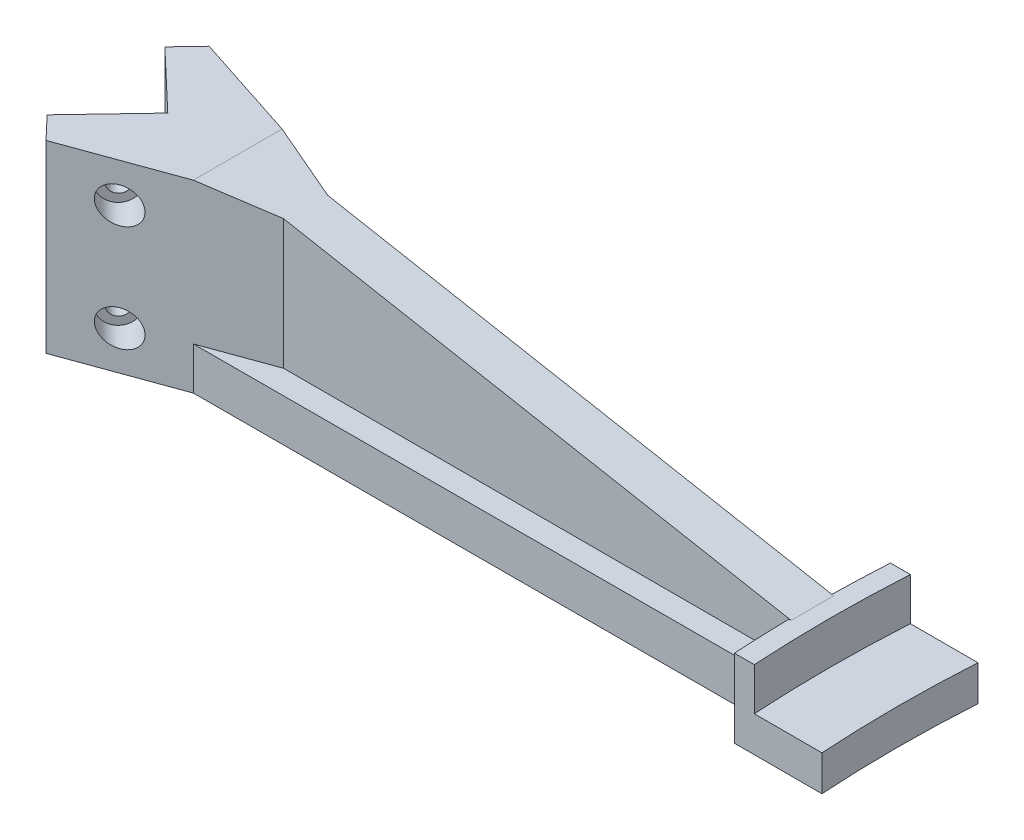
from build123d import *

# Parameters (mm, degrees)
BOSS_EXTRUDE2_DEPTH          = 12
BOSS_EXTRUDE3_START          = -2
BOSS_EXTRUDE3_DEPTH          = 10
BOSS_EXTRUDE4_START          = 10
BOSS_EXTRUDE4_DEPTH          = 22
BOSS_EXTRUDE7_DEPTH          = 40
BOSS_EXTRUDE17_DEPTH         = 6
BOSS_EXTRUDE17_DEPTH_BACK    = 6
CUT_EXTRUDE_THIN1_DEPTH      = 204.107832617
CUT_EXTRUDE_THIN1_DEPTH_BACK = 204.107832617
CUT_EXTRUDE1_START           = -8
SKETCH6_R                    = 5
CUT_EXTRUDE1_DEPTH           = 163.861994657
SKETCH6_4_R                  = 2.75
CUT_EXTRUDE2_DEPTH           = 171.861994657


with BuildPart() as part:
    # Sketch2 → Boss-Extrude2 (new body)
    with BuildSketch(Plane(origin=(0, 0, 0), x_dir=(1, 0, 0), z_dir=(0, 1, 0))):
        with BuildLine():
            Line((-197.696610314, 15.743442535), (-181.12456554, 0))
            Line((-181.12456554, 0), (-197.696610314, -17.444257657))
            Line((-197.696610314, -17.444257657), (-191.610767905, -23.850407561))
            Line((-191.610767905, -23.850407561), (-161.12456554, -12.777855375))
            Line((-161.12456554, -12.777855375), (0.21086679, -12.5))
            ThreePointArc((0.21086679, -12.5), (0.401744327, -17.25142014), (0.653571446, -22))
            Line((0.653571446, -22), (6.263616969, -22))
            ThreePointArc((6.263616969, -22), (5.6, 0), (6.263616969, 22))
            Line((6.263616969, 22), (0.653571446, 22))
            ThreePointArc((0.653571446, 22), (0.401744327, 17.25142014), (0.21086679, 12.5))
            Line((0.21086679, 12.5), (-161.12456554, 12.222144625))
            Line((-161.12456554, 12.222144625), (-191.610767905, 22.149592439))
            Line((-191.610767905, 22.149592439), (-197.696610314, 15.743442535))
        make_face()
    extrude(amount=-BOSS_EXTRUDE2_DEPTH)

    # Sketch2<5> → Boss-Extrude3 (add)
    with BuildSketch(Plane(origin=(0, 0, 0), x_dir=(1, 0, 0), z_dir=(0, 1, 0)).offset(BOSS_EXTRUDE3_START)):
        with BuildLine():
            Line((25.340211435, 22), (6.263616969, 22))
            ThreePointArc((6.263616969, 22), (5.6, 0), (6.263616969, -22))
            Line((6.263616969, -22), (25.340211435, -22))
            ThreePointArc((25.340211435, -22), (24.64, 0), (25.340211435, 22))
        make_face()
    extrude(amount=-BOSS_EXTRUDE3_DEPTH)

    # Sketch2<6> → Boss-Extrude4 (add)
    with BuildSketch(Plane(origin=(0, 0, 0), x_dir=(1, 0, 0), z_dir=(0, 1, 0)).offset(BOSS_EXTRUDE4_START)):
        with BuildLine():
            ThreePointArc((0.653571446, 22), (0.401744327, 17.25142014), (0.21086679, 12.5))
            ThreePointArc((0.21086679, 12.5), (0, 0), (0.21086679, -12.5))
            ThreePointArc((0.21086679, -12.5), (0.401744327, -17.25142014), (0.653571446, -22))
            Line((0.653571446, -22), (6.263616969, -22))
            ThreePointArc((6.263616969, -22), (5.6, 0), (6.263616969, 22))
            Line((6.263616969, 22), (0.653571446, 22))
        make_face()
    extrude(amount=-BOSS_EXTRUDE4_DEPTH)

    # Sketch2<9> → Boss-Extrude7 (add)
    with BuildSketch(Plane(origin=(0, 0, 0), x_dir=(1, 0, 0), z_dir=(0, 1, 0))):
        Polygon((-197.696610314, 15.743442535), (-181.12456554, 0), (-197.696610314, -17.444257657), (-191.610767905, -23.850407561), (-124.831467486, 0.40375437), (-191.610767905, 22.149592439), align=None)
    extrude(amount=BOSS_EXTRUDE7_DEPTH)

    # Sketch4 → Boss-Extrude17 (add, two sides: drawn at the far end of the back side and taken through both)
    with BuildSketch(Plane.XY.offset(-BOSS_EXTRUDE17_DEPTH_BACK)):
        Polygon((0.653571446, 10), (-161.12456554, 40), (-161.12456554, 0), (0.653571446, 0), align=None)
    extrude(amount=BOSS_EXTRUDE17_DEPTH + BOSS_EXTRUDE17_DEPTH_BACK)

    # Sketch5 → Cut-Extrude-Thin1 (cut, two sides: drawn at the far end of the back side and taken through both)
    with BuildSketch(Plane.XY.offset(-CUT_EXTRUDE_THIN1_DEPTH_BACK)):
        Polygon((0.653571446, 10), (-161.12456554, 40), (-159.301258723, 49.832372666), (2.476878263, 19.832372666), align=None)
    extrude(amount=CUT_EXTRUDE_THIN1_DEPTH + CUT_EXTRUDE_THIN1_DEPTH_BACK, mode=Mode.SUBTRACT)

    # Sketch6 → Cut-Extrude1 (cut, through all)
    with BuildSketch(Plane(origin=(-95.203451007, 0, -90.443278456), x_dir=(-0.6887494619146907, 0, 0.724999433594416), z_dir=(-0.724999433594416, 0, -0.6887494619146907)).offset(CUT_EXTRUDE1_START)):
        with Locations((134.749447055, 29)):
            Circle(SKETCH6_R)
        with Locations((134.749447055, -1)):
            Circle(SKETCH6_R)
    cut_extrude1 = extrude(amount=-CUT_EXTRUDE1_DEPTH, mode=Mode.SUBTRACT)

    # Sketch6<4> → Cut-Extrude2 (cut, symmetric)
    with BuildSketch(Plane(origin=(-95.203451007, 0, -90.443278456), x_dir=(-0.6887494619146907, 0, 0.724999433594416), z_dir=(-0.724999433594416, 0, -0.6887494619146907))):
        with Locations((134.749447055, 29)):
            Circle(SKETCH6_4_R)
        with Locations((134.749447055, -1)):
            Circle(SKETCH6_4_R)
    cut_extrude2 = extrude(amount=CUT_EXTRUDE2_DEPTH, both=True, mode=Mode.SUBTRACT)

    # Mirror1: Cut-Extrude1, Cut-Extrude2 across plane
    add(cut_extrude1.mirror(Plane.XY), mode=Mode.SUBTRACT)
    add(cut_extrude2.mirror(Plane.XY), mode=Mode.SUBTRACT)


solid = part.part
